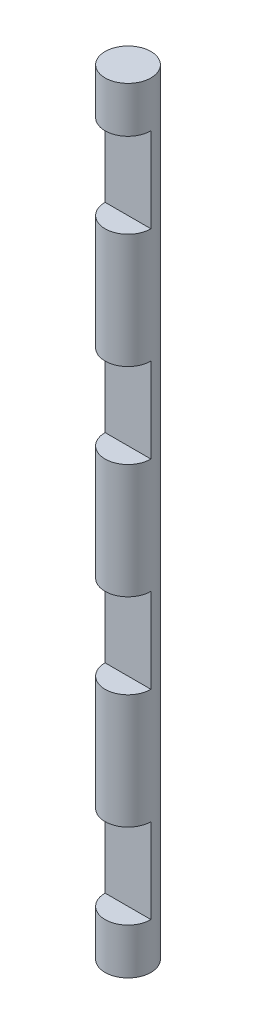
from build123d import *

# Parameters (mm, degrees)
SKETCH1_R           = 13
BOSS_EXTRUDE1_DEPTH = 1
SKETCH16_R          = 13
BOSS_EXTRUDE3_DEPTH = 1
SKETCH19_R          = 1
BOSS_EXTRUDE4_DEPTH = 29.8
SKETCH18_W          = 22
SKETCH18_H          = 22
CUT_EXTRUDE6_DEPTH  = 3.7
SKETCH21_W          = 22
SKETCH21_H          = 22
CUT_EXTRUDE7_DEPTH  = 3.7
SKETCH22_W          = 22
SKETCH22_H          = 22
CUT_EXTRUDE8_DEPTH  = 3.7
SKETCH23_W          = 22
SKETCH23_H          = 22
CUT_EXTRUDE9_DEPTH  = 3.7
SKETCH24_R          = 19.921792127
CUT_EXTRUDE10_DEPTH = 1
SKETCH25_R          = 36.182885583
CUT_EXTRUDE11_DEPTH = 1
SKETCH26_R          = 1
BOSS_EXTRUDE5_DEPTH = 2
BOSS_EXTRUDE6_START = 2
SKETCH27_R          = 1
BOSS_EXTRUDE6_DEPTH = 2


with BuildPart() as part:
    # Sketch1 → Boss-Extrude1 (new body)
    with BuildSketch(Plane(origin=(0, 0, 0), x_dir=(1, 0, 0), z_dir=(0, 1, 0))):
        with Locations(Location((0, 0, 0), (0, 0, 270))):
            Circle(SKETCH1_R)
    extrude(amount=BOSS_EXTRUDE1_DEPTH)



with BuildPart() as body_2:
    # Sketch16 → Boss-Extrude3 (new body)
    with BuildSketch(Plane(origin=(0, 30.8, 0), x_dir=(1, 0, 0), z_dir=(0, 1, 0))):
        with Locations(Location((0, 0, 0), (0, 0, 270))):
            Circle(SKETCH16_R)
    extrude(amount=BOSS_EXTRUDE3_DEPTH)


with BuildPart() as part_1:
    add(part.part)

    add(body_2.part)  # Boss-Extrude4 merges body 2
    # Sketch19 → Boss-Extrude4 (add)
    with BuildSketch(Plane(origin=(0, 1, 0), x_dir=(1, 0, 0), z_dir=(0, 1, 0))):
        with Locations(Location((0, 11, 0), (0, 0, 270))):
            Circle(SKETCH19_R)
    extrude(amount=BOSS_EXTRUDE4_DEPTH)

    # Sketch18 → Cut-Extrude6 (cut)
    with BuildSketch(Plane(origin=(0, 4.7, 0), x_dir=(1, 0, 0), z_dir=(0, 1, 0))):
        Rectangle(SKETCH18_W, SKETCH18_H)
    extrude(amount=-CUT_EXTRUDE6_DEPTH, mode=Mode.SUBTRACT)

    # Sketch21 → Cut-Extrude7 (cut)
    with BuildSketch(Plane(origin=(0, 13.4, 0), x_dir=(1, 0, 0), z_dir=(0, 1, 0))):
        Rectangle(SKETCH21_W, SKETCH21_H)
    extrude(amount=-CUT_EXTRUDE7_DEPTH, mode=Mode.SUBTRACT)

    # Sketch22 → Cut-Extrude8 (cut)
    with BuildSketch(Plane(origin=(0, 22.1, 0), x_dir=(1, 0, 0), z_dir=(0, 1, 0))):
        Rectangle(SKETCH22_W, SKETCH22_H)
    extrude(amount=-CUT_EXTRUDE8_DEPTH, mode=Mode.SUBTRACT)

    # Sketch23 → Cut-Extrude9 (cut)
    with BuildSketch(Plane(origin=(0, 30.8, 0), x_dir=(1, 0, 0), z_dir=(0, 1, 0))):
        Rectangle(SKETCH23_W, SKETCH23_H)
    extrude(amount=-CUT_EXTRUDE9_DEPTH, mode=Mode.SUBTRACT)

    # Sketch24 → Cut-Extrude10 (cut)
    with BuildSketch(Plane(origin=(0, 31.8, 0), x_dir=(1, 0, 0), z_dir=(0, 1, 0))):
        Circle(SKETCH24_R)
    extrude(amount=-CUT_EXTRUDE10_DEPTH, mode=Mode.SUBTRACT)

    # Sketch25 → Cut-Extrude11 (cut)
    with BuildSketch(Plane(origin=(0, 1, 0), x_dir=(1, 0, 0), z_dir=(0, 1, 0))):
        Circle(SKETCH25_R)
    extrude(amount=-CUT_EXTRUDE11_DEPTH, mode=Mode.SUBTRACT)

    # Sketch26 → Boss-Extrude5 (add)
    with BuildSketch(Plane(origin=(0, 30.8, 0), x_dir=(1, 0, 0), z_dir=(0, 1, 0))):
        with Locations((0, 11)):
            Circle(SKETCH26_R)
    extrude(amount=BOSS_EXTRUDE5_DEPTH)

    # Sketch27 → Boss-Extrude6 (add)
    with BuildSketch(Plane.XZ.offset(-1).offset(BOSS_EXTRUDE6_START)):
        with Locations(Location((0, -11, 0), (0, 0, 270))):
            Circle(SKETCH27_R)
    extrude(amount=-BOSS_EXTRUDE6_DEPTH)


solid = part_1.part
